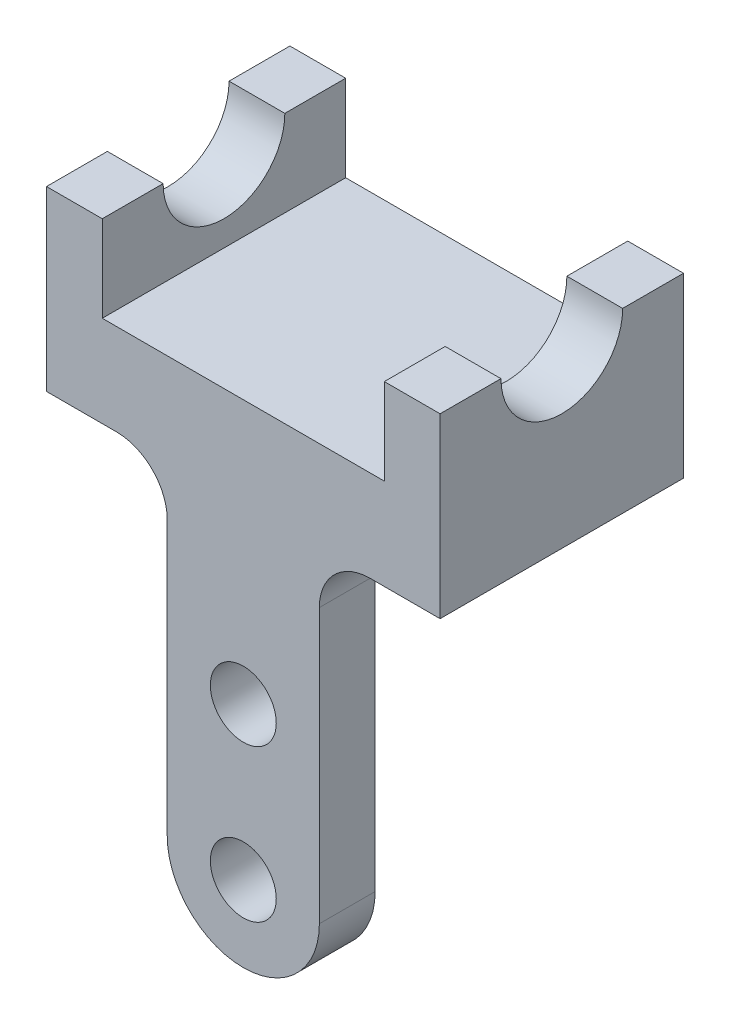
from build123d import *

# Parameters (mm, degrees)
SKETCH1_R           = 6.5
BOSS_EXTRUDE1_DEPTH = 11
BOSS_EXTRUDE2_DEPTH = 48
SKETCH2_R           = 12
CUT_EXTRUDE1_DEPTH  = 135.648061082


with BuildPart() as part:
    # Sketch1 → Boss-Extrude1 (new body)
    with BuildSketch(Plane.XY):
        with BuildLine():
            Line((25, 64), (-25, 64))
            ThreePointArc((-25, 64), (-17.928932188, 61.071067812), (-15, 54))
            Line((-15, 54), (-15, 0))
            ThreePointArc((-15, 0), (0, -15), (15, 0))
            Line((15, 0), (15, 54))
            ThreePointArc((15, 54), (17.928932188, 61.071067812), (25, 64))
        make_face()
        Circle(SKETCH1_R, mode=Mode.SUBTRACT)
        with Locations((0, 30)):
            Circle(SKETCH1_R, mode=Mode.SUBTRACT)
    extrude(amount=-BOSS_EXTRUDE1_DEPTH)

    # Sketch1<3> → Boss-Extrude2 (add)
    with BuildSketch(Plane.XY):
        Polygon((27.810759955, 82), (-27.810759955, 82), (-27.810759955, 99), (-38.810759955, 99), (-38.810759955, 64), (38.810759955, 64), (38.810759955, 99), (27.810759955, 99), align=None)
    extrude(amount=-BOSS_EXTRUDE2_DEPTH)

    # Sketch2 → Cut-Extrude1 (cut, through all)
    with BuildSketch(Plane(origin=(38.810759955, 0, 0), x_dir=(0, 0, -1), z_dir=(1, 0, 0))):
        with Locations((24, 99)):
            Circle(SKETCH2_R)
    extrude(amount=-CUT_EXTRUDE1_DEPTH, mode=Mode.SUBTRACT)


solid = part.part
